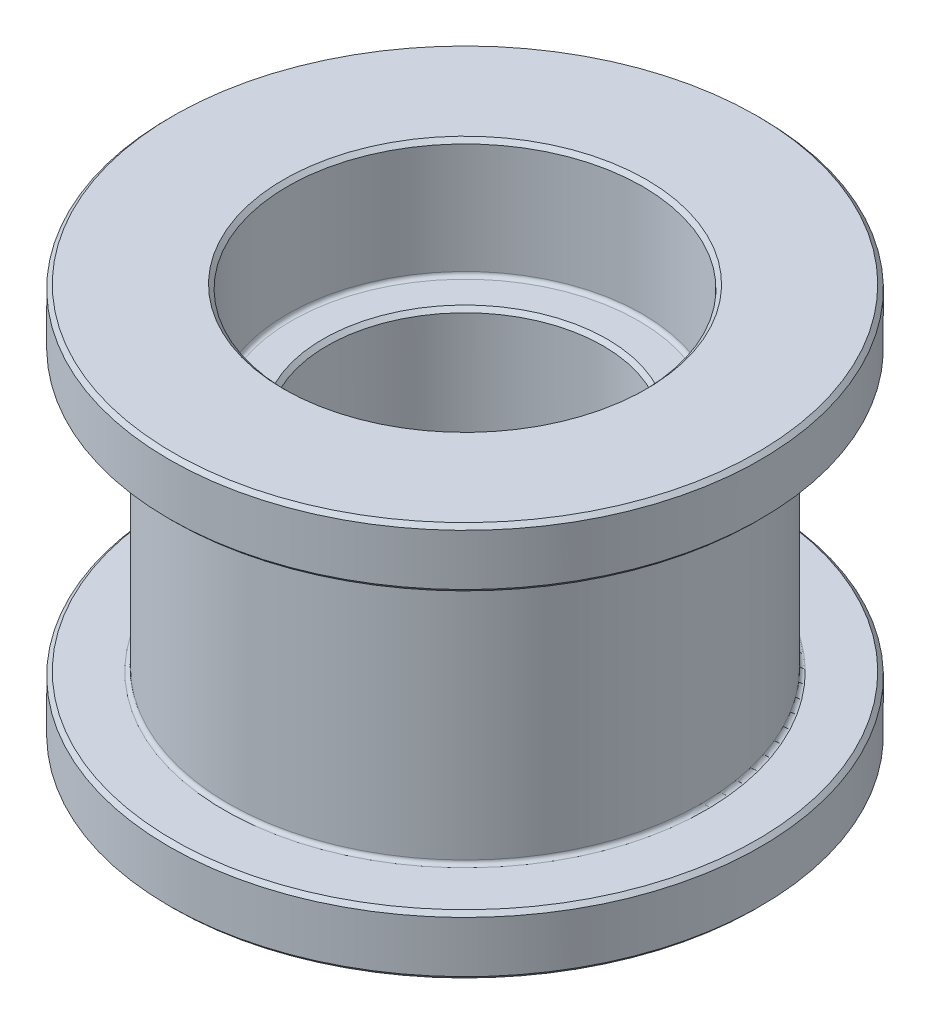
from build123d import *

# Parameters (mm, degrees)
ZKOSEN_1_SIZE = 0.1
ZAOBLIT1_R    = 0.1


with BuildPart() as part:
    # Skica1 → Rotovat1 (revolve)
    with BuildSketch(Plane.XY, mode=Mode.PRIVATE) as rotovat1_sk:
        Polygon((4.5, 10), (7.5, 10), (7.5, 8.5), (6, 8.5), (6, 1.5), (7.5, 1.5), (7.5, 0), (4.5, 0), (4.5, 3), (3.5, 3), (3.5, 7), (4.5, 7), align=None)
    revolve(rotovat1_sk.sketch.rotate(Axis((0, 0, 0), (0, -1, 0)), 90), axis=Axis((0, 0, 0), (0, -1, 0)))

    # Zkosení1
    zkosen_1_edges = [part.edges().sort_by_distance(p)[0] for p in [
        (0, 3, -3.5),
        (0, 0, -4.5),
        (0, 0, -7.5),
        (0, 1.5, -7.5),
        (0, 8.5, -7.5),
        (0, 10, -7.5),
        (0, 10, -4.5),
        (0, 7, -3.5),
    ]]
    chamfer(zkosen_1_edges, length=ZKOSEN_1_SIZE)

    # Zaoblit1
    zaoblit1_edges = [part.edges().sort_by_distance(p)[0] for p in [
        (0, 3, -4.5),
        (0, 1.5, -6),
        (0, 8.5, -6),
        (0, 7, -4.5),
    ]]
    fillet(zaoblit1_edges, radius=ZAOBLIT1_R)


solid = part.part
